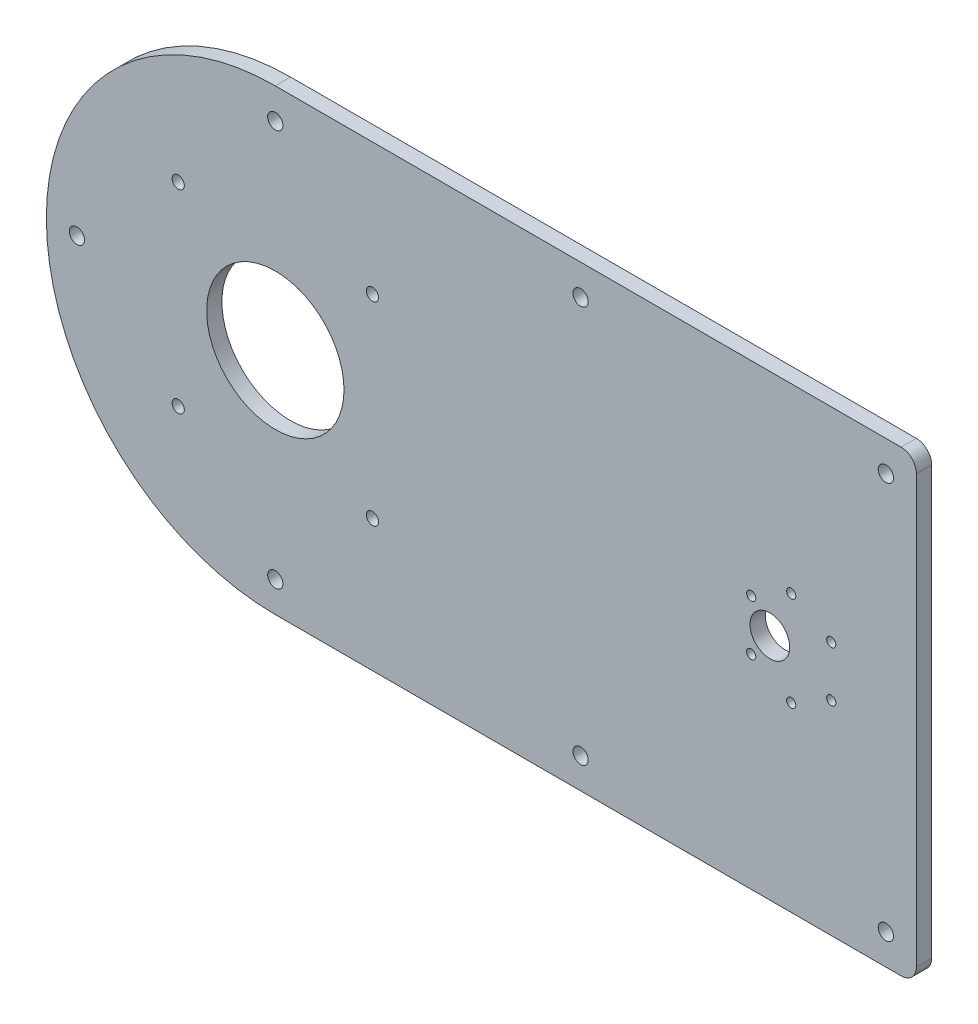
from build123d import *

# Parameters (mm, degrees)
SKETCH1_R           = 2.5
SKETCH1_R_2         = 22.5
SKETCH1_R_3         = 2
SKETCH1_R_4         = 6.5
SKETCH1_R_5         = 1.5
BOSS_EXTRUDE1_DEPTH = 5


with BuildPart() as part:
    # Sketch1 → Boss-Extrude1 (new body)
    with BuildSketch(Plane.XY):
        with BuildLine():
            Line((30.000692042, 92.545526446), (235.000692042, 92.545526446))
            ThreePointArc((235.000692042, 92.545526446), (238.536225947, 91.081060352), (240.000692042, 87.545526446))
            Line((240.000692042, 87.545526446), (240.000692042, -52.454473554))
            ThreePointArc((240.000692042, -52.454473554), (238.536225947, -55.99000746), (235.000692042, -57.454473554))
            Line((235.000692042, -57.454473554), (30.000692042, -57.454473554))
            ThreePointArc((30.000692042, -57.454473554), (-44.999307958, 17.545526446), (30.000692042, 92.545526446))
        make_face()
        with Locations((-34.999307958, 17.545526446)):
            Circle(SKETCH1_R, mode=Mode.SUBTRACT)
        with Locations((30.000692042, -47.454473554)):
            Circle(SKETCH1_R, mode=Mode.SUBTRACT)
        with Locations((30.000692042, 82.545526446)):
            Circle(SKETCH1_R, mode=Mode.SUBTRACT)
        with Locations((230.000692042, -47.454473554)):
            Circle(SKETCH1_R, mode=Mode.SUBTRACT)
        with Locations((230.000692042, 82.545526446)):
            Circle(SKETCH1_R, mode=Mode.SUBTRACT)
        with Locations((130.000692042, 82.545526446)):
            Circle(SKETCH1_R, mode=Mode.SUBTRACT)
        with Locations((130.000692042, -47.454473554)):
            Circle(SKETCH1_R, mode=Mode.SUBTRACT)
        with Locations((30.000692042, 17.545526446)):
            Circle(SKETCH1_R_2, mode=Mode.SUBTRACT)
        with Locations((61.815692042, 49.360526446)):
            Circle(SKETCH1_R_3, mode=Mode.SUBTRACT)
        with Locations((61.815692042, -14.269473554)):
            Circle(SKETCH1_R_3, mode=Mode.SUBTRACT)
        with Locations((-1.814307958, -14.269473554)):
            Circle(SKETCH1_R_3, mode=Mode.SUBTRACT)
        with Locations((-1.814307958, 49.360526446)):
            Circle(SKETCH1_R_3, mode=Mode.SUBTRACT)
        with Locations((192.000692042, 17.545526446)):
            Circle(SKETCH1_R_4, mode=Mode.SUBTRACT)
        with Locations((199.000692042, 33.045526446)):
            Circle(SKETCH1_R_5, mode=Mode.SUBTRACT)
        with Locations((199.000692042, 2.045526446)):
            Circle(SKETCH1_R_5, mode=Mode.SUBTRACT)
        with Locations((185.893407347, 25.818922843)):
            Circle(SKETCH1_R_5, mode=Mode.SUBTRACT)
        with Locations((212.107976736, 25.818922843)):
            Circle(SKETCH1_R_5, mode=Mode.SUBTRACT)
        with Locations((212.107976736, 9.272130049)):
            Circle(SKETCH1_R_5, mode=Mode.SUBTRACT)
        with Locations((185.893407347, 9.272130049)):
            Circle(SKETCH1_R_5, mode=Mode.SUBTRACT)
    extrude(amount=BOSS_EXTRUDE1_DEPTH)


solid = part.part
